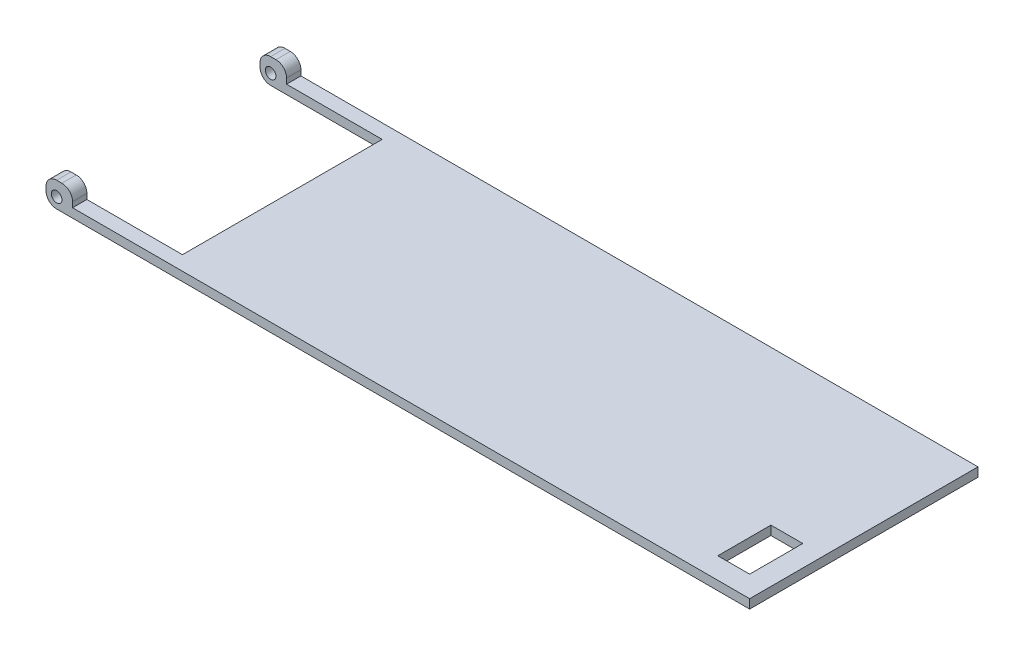
from build123d import *

# Parameters (mm, degrees)
SKETCH1_W            = 132.5
SKETCH1_H            = 43
BOSS_EXTRUDE1_DEPTH  = 1.7
SKETCH2_W            = 23
SKETCH2_H            = 37.6
CUT_EXTRUDE1_DEPTH   = 1.7
SKETCH4_W            = 5
SKETCH4_H            = 2.7
BOSS_EXTRUDE2_DEPTH  = 3
SKETCH5_R            = 1
CUT_EXTRUDE2_DEPTH   = 2.7
FILLET1_R            = 2
FILLET1_OF_MIRROR2_R = 2
SKETCH10_W           = 6
SKETCH10_H           = 10
CUT_EXTRUDE3_DEPTH   = 1.7


with BuildPart() as part:
    # Sketch1 → Boss-Extrude1 (new body)
    with BuildSketch(Plane(origin=(0, 0, 0), x_dir=(1, 0, 0), z_dir=(0, 1, 0))):
        Rectangle(SKETCH1_W, SKETCH1_H)
    extrude(amount=BOSS_EXTRUDE1_DEPTH)

    # Sketch2 → Cut-Extrude1 (cut)
    with BuildSketch(Plane(origin=(0, 1.7, 0), x_dir=(1, 0, 0), z_dir=(0, 1, 0))):
        with Locations((-54.75, 0)):
            Rectangle(SKETCH2_W, SKETCH2_H)
    extrude(amount=-CUT_EXTRUDE1_DEPTH, mode=Mode.SUBTRACT)

    # Sketch4 → Boss-Extrude2 (add)
    with BuildSketch(Plane(origin=(0, 1.7, 0), x_dir=(1, 0, 0), z_dir=(0, 1, 0))):
        with Locations((-63.75, -20.15)):
            Rectangle(SKETCH4_W, SKETCH4_H)
    boss_extrude2 = extrude(amount=BOSS_EXTRUDE2_DEPTH)

    # Sketch5 → Cut-Extrude2 (cut)
    with BuildSketch(Plane.XY.offset(21.5)):
        with Locations((-64.25, 2)):
            Circle(SKETCH5_R)
    cut_extrude2 = extrude(amount=-CUT_EXTRUDE2_DEPTH, mode=Mode.SUBTRACT)

    # Fillet1
    fillet1_edges = [part.edges().sort_by_distance(p)[0] for p in [
        (-66.25, 0, 20.15),
        (-66.25, 4.7, 20.15),
        (-61.25, 4.7, 20.15),
    ]]
    fillet(fillet1_edges, radius=FILLET1_R)

    # Mirror2: Boss-Extrude2, Cut-Extrude2 across plane
    add(boss_extrude2.mirror(Plane.XY))
    add(cut_extrude2.mirror(Plane.XY), mode=Mode.SUBTRACT)

    # Fillet1 of Mirror2
    fillet1_of_mirror2_edges = [part.edges().sort_by_distance(p)[0] for p in [
        (-66.25, 0, -20.15),
        (-66.25, 4.7, -20.15),
        (-61.25, 4.7, -20.15),
    ]]
    fillet(fillet1_of_mirror2_edges, radius=FILLET1_OF_MIRROR2_R)

    # Sketch10 → Cut-Extrude3 (cut)
    with BuildSketch(Plane(origin=(0, 1.7, 0), x_dir=(1, 0, 0), z_dir=(0, 1, 0))):
        with Locations((59.25, -12.5)):
            Rectangle(SKETCH10_W, SKETCH10_H)
    extrude(amount=-CUT_EXTRUDE3_DEPTH, mode=Mode.SUBTRACT)


solid = part.part
